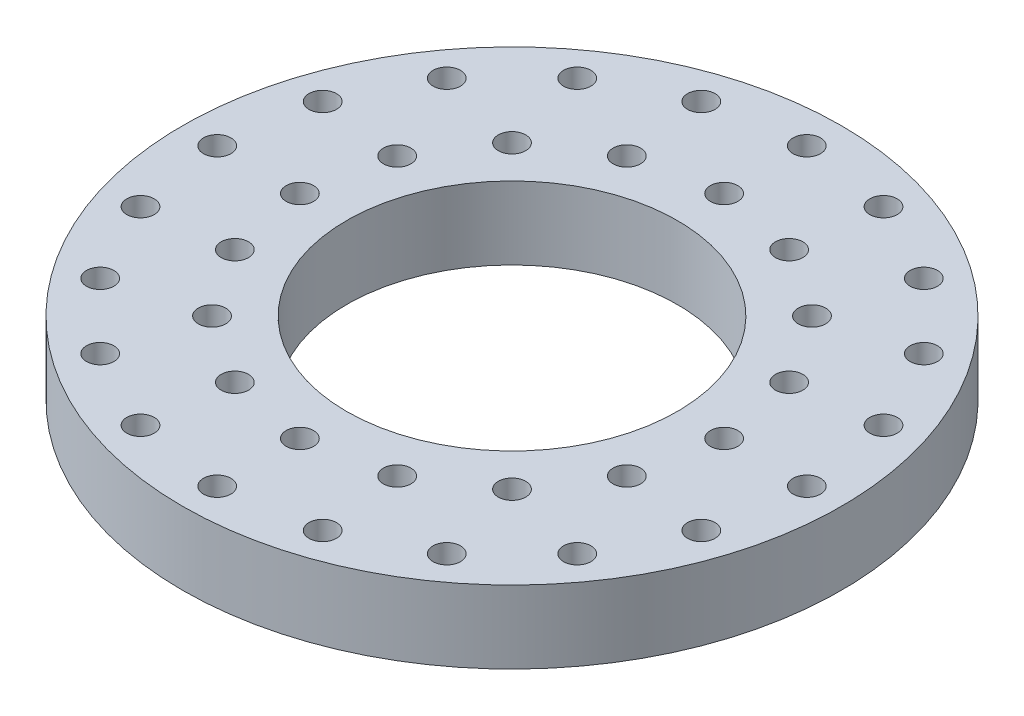
from build123d import *

# Parameters (mm, degrees)
SKETCH1_R          = 101.219
EXTRUDE1_DEPTH     = 22.352
SKETCH2_R          = 50.8
CUT_EXTRUDE1_DEPTH = 22.352
SKETCH3_R          = 4.2164
CUT_EXTRUDE3_DEPTH = 22.352
CIRPATTERN1_COUNT  = 16
SKETCH4_R          = 4.2164
CUT_EXTRUDE4_DEPTH = 22.352
CIRPATTERN2_COUNT  = 20


with BuildPart() as part:
    # Sketch1 → Extrude1 (new body)
    with BuildSketch(Plane(origin=(0, 0, 0), x_dir=(1, 0, 0), z_dir=(0, 1, 0))):
        Circle(SKETCH1_R)
    extrude(amount=EXTRUDE1_DEPTH)

    # Sketch2 → Cut-Extrude1 (cut)
    with BuildSketch(Plane(origin=(0, 0, 0), x_dir=(1, 0, 0), z_dir=(0, 1, 0))):
        Circle(SKETCH2_R)
    extrude(amount=CUT_EXTRUDE1_DEPTH, mode=Mode.SUBTRACT)

    # Sketch3 → Cut-Extrude3 (cut)
    with BuildSketch(Plane(origin=(0, 0, 0), x_dir=(1, 0, 0), z_dir=(0, 1, 0))):
        with Locations((0, 65.151)):
            Circle(SKETCH3_R)
    cut_extrude3 = extrude(amount=CUT_EXTRUDE3_DEPTH, mode=Mode.SUBTRACT)

    # CirPattern1: Cut-Extrude3 ×16 about axis
    cirpattern1_axis = Axis((0, 103.923475146, 0), (0, -1, 0))
    for i in range(1, CIRPATTERN1_COUNT):
        add(cut_extrude3.rotate(cirpattern1_axis, i * 360 / CIRPATTERN1_COUNT), mode=Mode.SUBTRACT)

    # Sketch4 → Cut-Extrude4 (cut)
    with BuildSketch(Plane(origin=(0, 0, 0), x_dir=(1, 0, 0), z_dir=(0, 1, 0))):
        with Locations((0, 90.551)):
            Circle(SKETCH4_R)
    cut_extrude4 = extrude(amount=CUT_EXTRUDE4_DEPTH, mode=Mode.SUBTRACT)

    # CirPattern2: Cut-Extrude4 ×20 about axis
    cirpattern2_axis = Axis((0, 103.923475146, 0), (0, -1, 0))
    for i in range(1, CIRPATTERN2_COUNT):
        add(cut_extrude4.rotate(cirpattern2_axis, i * 360 / CIRPATTERN2_COUNT), mode=Mode.SUBTRACT)


solid = part.part
